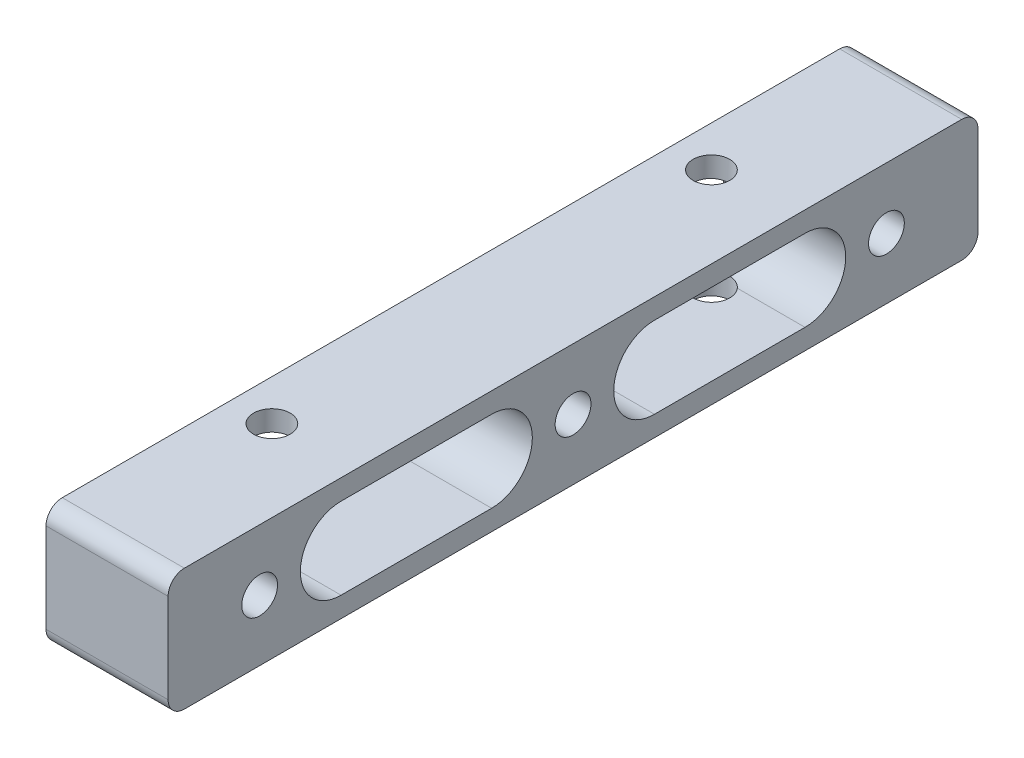
from build123d import *

# Parameters (mm, degrees)
SKETCH_1_W          = 99.5
SKETCH_1_H          = 15
EXTRUDE_1_DEPTH     = 15
SKETCH_2_R          = 2.2
CUT_EXTRUDE_1_DEPTH = 55
CUT_EXTRUDE_2_DEPTH = 48
FILLET_1_R          = 2
CUT_EXTRUDE_3_DEPTH = 31


with BuildPart() as part:
    # 草图1 → 凸台-拉伸1 (new body)
    with BuildSketch(Plane(origin=(0, 0, 0), x_dir=(0, 0, -1), z_dir=(1, 0, 0))):
        with Locations((49.75, -7.5)):
            Rectangle(SKETCH_1_W, SKETCH_1_H)
    extrude(amount=EXTRUDE_1_DEPTH)

    # 草图2 → 切除-拉伸1 (cut)
    with BuildSketch(Plane(origin=(15, 0, 0), x_dir=(0, 0, -1), z_dir=(1, 0, 0))):
        with Locations((49.75, -7.5)):
            Circle(SKETCH_2_R)
        with Locations((11.25, -7.5)):
            Circle(SKETCH_2_R)
        with Locations((88.25, -7.5)):
            Circle(SKETCH_2_R)
    extrude(amount=-CUT_EXTRUDE_1_DEPTH, mode=Mode.SUBTRACT)

    # 草图3 → 切除-拉伸2 (cut)
    with BuildSketch(Plane(origin=(15, 0, 0), x_dir=(0, 0, -1), z_dir=(1, 0, 0))):
        with BuildLine():
            Line((21.25, -2.5), (39.75, -2.5))
            ThreePointArc((39.75, -2.5), (44.75, -7.5), (39.75, -12.5))
            Line((39.75, -12.5), (21.25, -12.5))
            ThreePointArc((21.25, -12.5), (16.25, -7.5), (21.25, -2.5))
        make_face()
        with BuildLine():
            Line((59.75, -2.5), (78.25, -2.5))
            ThreePointArc((78.25, -2.5), (83.25, -7.5), (78.25, -12.5))
            Line((78.25, -12.5), (59.75, -12.5))
            ThreePointArc((59.75, -12.5), (54.75, -7.5), (59.75, -2.5))
        make_face()
    extrude(amount=-CUT_EXTRUDE_2_DEPTH, mode=Mode.SUBTRACT)

    # 圆角1
    fillet_1_edges = [part.edges().sort_by_distance(p)[0] for p in [
        (7.5, 0, 0),
        (7.5, 0, -99.5),
        (7.5, -15, -99.5),
        (7.5, -15, 0),
    ]]
    fillet(fillet_1_edges, radius=FILLET_1_R)

    # 草图4 → 切除-拉伸3 (cut)
    with BuildSketch(Plane(origin=(0, 0, 0), x_dir=(1, 0, 0), z_dir=(0, 1, 0))):
        with BuildLine():
            ThreePointArc((7.25, 22.75), (6.590990258, 24.340990258), (5, 25))
            Line((5, 25), (5, 20.5))
            ThreePointArc((5, 20.5), (6.590990258, 21.159009742), (7.25, 22.75))
        make_face()
        with BuildLine():
            Line((5, 20.5), (5, 25))
            ThreePointArc((5, 25), (2.75, 22.75), (5, 20.5))
        make_face()
        with BuildLine():
            ThreePointArc((7.25, 76.75), (6.590990258, 78.340990258), (5, 79))
            Line((5, 79), (5, 74.5))
            ThreePointArc((5, 74.5), (6.590990258, 75.159009742), (7.25, 76.75))
        make_face()
        with BuildLine():
            Line((5, 74.5), (5, 79))
            ThreePointArc((5, 79), (2.75, 76.75), (5, 74.5))
        make_face()
    extrude(amount=-CUT_EXTRUDE_3_DEPTH, mode=Mode.SUBTRACT)


solid = part.part
